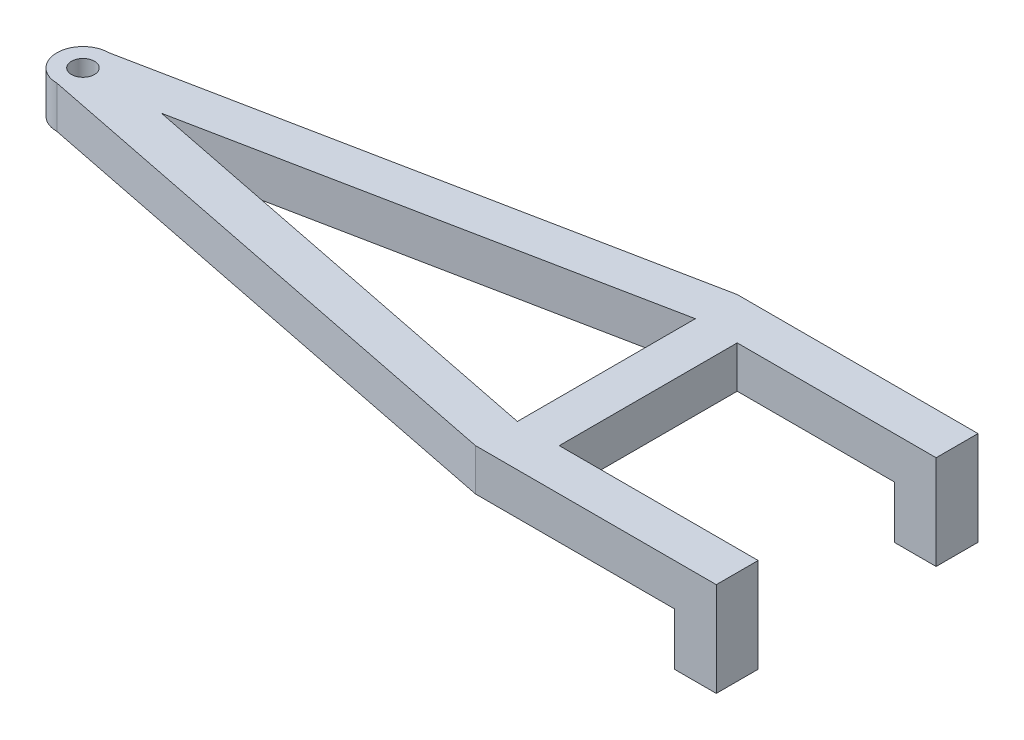
from build123d import *

# Parameters (mm, degrees)
SKETCH1_R           = 1.1
BOSS_EXTRUDE1_DEPTH = 4
SKETCH2_W           = 4
SKETCH2_H           = 4
BOSS_EXTRUDE2_DEPTH = 5


with BuildPart() as part:
    # Sketch1 → Boss-Extrude1 (new body)
    with BuildSketch(Plane(origin=(0, 0, 0), x_dir=(1, 0, 0), z_dir=(0, 1, 0))):
        with BuildLine():
            Line((15.760200843, 53.402286132), (-34.239799157, 43.402286132))
            ThreePointArc((-34.239799157, 43.402286132), (-36.739799157, 40.902286132), (-34.239799157, 38.402286132))
            Line((-34.239799157, 38.402286132), (15.760200843, 28.402286132))
            Line((15.760200843, 28.402286132), (38.760200843, 28.402286132))
            Line((38.760200843, 28.402286132), (38.760200843, 32.402286132))
            Line((38.760200843, 32.402286132), (19.760200843, 32.402286132))
            Line((19.760200843, 32.402286132), (19.760200843, 49.402286132))
            Line((19.760200843, 49.402286132), (38.760200843, 49.402286132))
            Line((38.760200843, 49.402286132), (38.760200843, 53.402286132))
            Line((38.760200843, 53.402286132), (15.760200843, 53.402286132))
        make_face()
        Polygon((-26.739799157, 40.902286132), (15.760200843, 49.402286132), (15.760200843, 32.402286132), align=None, mode=Mode.SUBTRACT)
        with Locations((-34.239799157, 40.902286132)):
            Circle(SKETCH1_R, mode=Mode.SUBTRACT)
    extrude(amount=BOSS_EXTRUDE1_DEPTH)

    # Sketch2 → Boss-Extrude2 (add)
    with BuildSketch(Plane.XZ):
        with Locations((36.760200843, -30.402286132)):
            Rectangle(SKETCH2_W, SKETCH2_H)
        with Locations((36.760200843, -51.402286132)):
            Rectangle(SKETCH2_W, SKETCH2_H)
    extrude(amount=BOSS_EXTRUDE2_DEPTH)


solid = part.part
